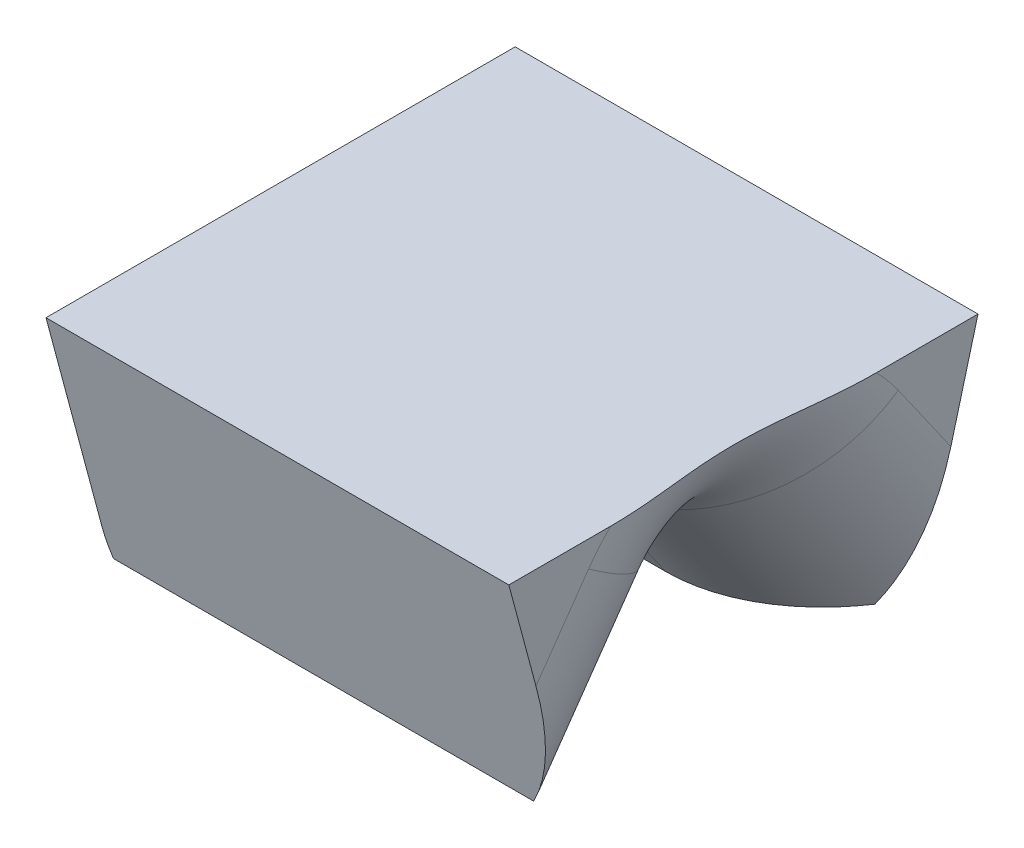
from build123d import *

# Parameters (mm, degrees)
SKETCH_TL_CUTTING_R    = 1.4986
TL_CUTTING_DEPTH       = 75.9968
SKETCH_TDF_CUTTING_W   = 3.01719996
SKETCH_TDF_CUTTING_H   = 3.01719996
TDF_CUTTING_DEPTH      = 77.026345527
VW_VR_GRINDING_DEPTH   = 1.4986
VW_VR_GRINDING_2_DEPTH = 1.4986
ISA_GRINDING_DEPTH     = 1.4986
SKETCH_PRE_FRX_BRX_W   = 1.21682002
SKETCH_PRE_FRX_BRX_H   = 0.83312
SKETCH_PRE_FRX_BRX_W_2 = 1.24935996
PRE_FRX_BRX_DEPTH      = 1.4986
FA_BA_GRINDING_DEPTH   = 1.4986
FR_EDM_R               = 0.1016
BR_EDM_R               = 0.20066
SKETCH_ENGRAVING_W     = 0.033186299
SKETCH_ENGRAVING_H     = 1.128593452
SKETCH_ENGRAVING_H_2   = 1.128593453
ENGRAVING_DEPTH        = 0.005


with BuildPart() as part:
    # sketch_TL_cutting → TL_cutting (new body)
    with BuildSketch(Plane(origin=(0, 0, 0), x_dir=(1, 0, 0), z_dir=(0, 1, 0))):
        with Locations(Location((0, 0, 0), (0, 0, 270))):
            Circle(SKETCH_TL_CUTTING_R)
    extrude(amount=TL_CUTTING_DEPTH)

    # sketch_TDF_cutting → TDF_cutting (cut, through all)
    with BuildSketch(Plane(origin=(0, 0, 0), x_dir=(1, 0, 0), z_dir=(0, 1, 0))):
        with Locations((-2.71001998, 0)):
            Rectangle(SKETCH_TDF_CUTTING_W, SKETCH_TDF_CUTTING_H)
    extrude(amount=TDF_CUTTING_DEPTH, mode=Mode.SUBTRACT)


with BuildPart() as body_2:
    # sketch_VW_VR_grinding → VW_VR_grinding (new, symmetric)
    with BuildSketch(Plane(origin=(0, 0, 0), x_dir=(0, 0, -1), z_dir=(1, 0, 0))):
        with BuildLine():
            Line((-1.49360001, -0.00999998), (-1.49360001, 0.822008914))
            ThreePointArc((-1.49360001, 0.822008914), (-1.493648337, 0.823115792), (-1.493792952, 0.824214246))
            Line((-1.493792952, 0.824214246), (-1.51859996, 0.964901782))
            Line((-1.51859996, 0.964901782), (-1.50859998, -0.00999998))
            Line((-1.50859998, -0.00999998), (-1.49360001, -0.00999998))
        make_face()
    extrude(amount=VW_VR_GRINDING_DEPTH, both=True)


with BuildPart() as body_3:
    # sketch_VW_VR_grinding → VW_VR_grinding 2 (new, symmetric)
    with BuildSketch(Plane(origin=(0, 0, 0), x_dir=(0, 0, -1), z_dir=(1, 0, 0))):
        with BuildLine():
            Line((1.49360001, -0.00999998), (1.49360001, 0.822008914))
            ThreePointArc((1.49360001, 0.822008914), (1.493648337, 0.823115792), (1.493792952, 0.824214246))
            Line((1.493792952, 0.824214246), (1.51859996, 0.964901782))
            Line((1.51859996, 0.964901782), (1.50859998, -0.00999998))
            Line((1.50859998, -0.00999998), (1.49360001, -0.00999998))
        make_face()
    extrude(amount=VW_VR_GRINDING_2_DEPTH, both=True)


    add(body_2.part)  # ISA_grinding merges body 2
    # sketch_ISA_grinding → ISA_grinding (add, symmetric)
    with BuildSketch(Plane(origin=(0, 0, 0), x_dir=(0, 0, -1), z_dir=(1, 0, 0))):
        Polygon((-0.19939, 0), (0.19939, 0), (1.50859998, 4.886038163), (1.50859998, -0.02999994), (-1.50859998, -0.02999994), (-1.50859998, 4.886038163), align=None)
    extrude(amount=ISA_GRINDING_DEPTH, both=True)

    # sketch_pre_FRX_BRX → pre_FRX_BRX (add, symmetric)
    with BuildSketch(Plane.XY):
        with Locations((0.89018999, 0.40656002)):
            Rectangle(SKETCH_PRE_FRX_BRX_W, SKETCH_PRE_FRX_BRX_H)
        with Locations((-0.89391998, 0.40656002)):
            Rectangle(SKETCH_PRE_FRX_BRX_W_2, SKETCH_PRE_FRX_BRX_H)
    extrude(amount=PRE_FRX_BRX_DEPTH, both=True)

    # sketch_FA_BA_grinding → FA_BA_grinding (add, symmetric)
    with BuildSketch(Plane.XY):
        Polygon((0.27178, -0.00999998), (0.27178, 0.83312), (1.6256, 10.466049838), (1.6256, -0.00999998), align=None)
        Polygon((-0.26924, -0.00999998), (-0.26924, 0.83312), (-1.32842, 8.369577303), (-1.32842, -0.00999998), align=None)
    extrude(amount=FA_BA_GRINDING_DEPTH, both=True)


with BuildPart() as part_1:
    add(part.part)

    # B1_fix: cut body 3
    add(body_3.part, mode=Mode.SUBTRACT)

    # V-Groove_EDM: sweep along a path in sketch_contour_V-Groove
    with BuildLine(Plane.XY) as v_groove_edm_path:
        Line((-1.20142, 0.14224), (1.4986, 0.14224))
    # sketch_section_V-Groove → V-Groove_EDM (sweep, cut)
    with BuildSketch(Plane(origin=(-1.20142, 0, -1.2954), x_dir=(0, 0, -1), z_dir=(1, 0, 0))):
        with BuildLine():
            Line((-1.27875483, 0.133575073), (-1.178222496, -0.00999998))
            Line((-1.178222496, -0.00999998), (-1.412577504, -0.00999998))
            Line((-1.412577504, -0.00999998), (-1.31204517, 0.133575073))
            ThreePointArc((-1.31204517, 0.133575073), (-1.2954, 0.14224), (-1.27875483, 0.133575073))
        make_face()
    sweep(path=v_groove_edm_path.line, mode=Mode.SUBTRACT)

    # FR_EDM
    fr_edm_edges = [part_1.edges().sort_by_distance(p)[0] for p in [
        (-0.26924, 0.14224, 0),
        (-0.26924, 0.066787537, -0.063410306),
        (-0.26924, 0.066787537, 0.063410306),
    ]]
    fillet(fr_edm_edges, radius=FR_EDM_R)

    # BR_EDM
    br_edm_edges = [part_1.edges().sort_by_distance(p)[0] for p in [
        (0.27178, 0.066787537, 0.063410306),
        (0.27178, 0.14224, 0),
        (0.27178, 0.066787537, -0.063410306),
    ]]
    fillet(br_edm_edges, radius=BR_EDM_R)

    # sketch_Engraving → Engraving (cut)
    # profile 1 of 14: a face of its own
    with BuildSketch(Plane.ZY.offset(1.20142)):
        Polygon((0.531688452, 45.269846756), (0.531688452, 44.551415224), (0.030264207, 44.92787231), (0.030264207, 44.765052028), (-0.034552784, 44.633862437), (-0.102740259, 44.56723057), (-0.296154161, 44.503450651), (-0.425528876, 44.503450651), (-0.618942778, 44.56723057), (-0.749354564, 44.69842016), (-0.81235668, 44.891834063), (-0.81235668, 45.083433089), (-0.749354564, 45.276846991), (-0.682722697, 45.345293734), (-0.555940662, 45.408295849), (-0.541940192, 45.382887589), (-0.665351744, 45.320663277), (-0.724724108, 45.262846521), (-0.785133544, 45.080062605), (-0.785133544, 44.895463814), (-0.724724108, 44.712420631), (-0.604164504, 44.592638831), (-0.42112132, 44.531451591), (-0.299524645, 44.531451591), (-0.116740729, 44.592638831), (-0.059701777, 44.652270463), (0.001485463, 44.772052263), (0.001485463, 44.985429798), (0.502909708, 44.60923198), (0.502909708, 45.269846756), align=None)
    # profile 2 of 14: a face of its own
    with BuildSketch(Plane.ZY.offset(1.20142)):
        Polygon((-0.79576353, 43.729743189), (-0.79576353, 43.758521933), (0.483723879, 43.758521933), (0.316755309, 43.923157091), (0.254530997, 44.049939126), (0.278902186, 44.064976668), (0.341904302, 43.940528044), (0.531688452, 43.74996609), (0.531688452, 43.729743189), align=None)
    # profile 3 of 14: a face of its own
    with BuildSketch(Plane.ZY.offset(1.20142)):
        Polygon((-0.79576353, 42.579837909), (-0.79576353, 42.608616653), (0.483723879, 42.608616653), (0.316755309, 42.773251811), (0.254530997, 42.900033846), (0.278902186, 42.915071388), (0.341904302, 42.790622765), (0.531688452, 42.60006081), (0.531688452, 42.579837909), align=None)
    # profile 4 of 14: a face of its own
    with BuildSketch(Plane.ZY.offset(1.20142)):
        Polygon((-0.786170615, 41.055549687), (-0.79576353, 41.079920876), (-0.367193584, 41.245333838), (-0.367193584, 41.893763019), (-0.79576353, 42.059175981), (-0.786170615, 42.08354717), (0.531688452, 41.578752441), (0.531688452, 41.559566612), align=None)
        Polygon((-0.340748251, 41.255704557), (0.478538519, 41.569159527), (-0.340748251, 41.883133033), align=None, mode=Mode.SUBTRACT)
    # profile 5 of 14: a face of its own
    with BuildSketch(Plane.ZY.offset(1.20142)):
        with Locations((-0.231596438, 40.285083075)):
            Rectangle(SKETCH_ENGRAVING_W, SKETCH_ENGRAVING_H)
    # profile 6 of 14: a face of its own
    with BuildSketch(Plane.ZY.offset(1.20142)):
        Polygon((0.515095302, 38.490248732), (-0.79576353, 38.988821029), (-0.79576353, 39.018636845), (0.521058466, 39.518246214), (0.531688452, 39.493875025), (-0.756354799, 39.003858571), (0.525466021, 38.514619921), align=None)
    # profile 7 of 14: a face of its own
    with BuildSketch(Plane.ZY.offset(1.20142)):
        Polygon((-0.786170615, 38.108295165), (0.502909708, 37.49227448), (0.502909708, 38.347080961), (0.531688452, 38.347080961), (0.531688452, 37.44508771), (-0.79576353, 38.083664709), align=None)
    # profile 8 of 14: a face of its own
    with BuildSketch(Plane.ZY.offset(1.20142)):
        Polygon((-0.554125786, 36.366740389), (-0.749354564, 36.498189247), (-0.81235668, 36.693158757), (-0.81235668, 36.82279274), (-0.749354564, 37.01776225), (-0.554125786, 37.148174036), (-0.237559601, 37.211176152), (-0.044923503, 37.211176152), (0.271901951, 37.148174036), (0.466871461, 37.01776225), (0.531688452, 36.82279274), (0.531688452, 36.693158757), (0.466871461, 36.498189247), (0.271901951, 36.366740389), (-0.044923503, 36.304775345), (-0.237559601, 36.304775345), align=None)
        Polygon((-0.539347512, 36.395778401), (-0.22874449, 36.332776285), (-0.044923503, 36.332776285), (0.26567952, 36.395778401), (0.446907827, 36.515560201), (0.507057995, 36.696788509), (0.507057995, 36.818385184), (0.446907827, 36.999613492), (0.26567952, 37.120173096), (-0.044923503, 37.182397408), (-0.22874449, 37.182397408), (-0.539347512, 37.120173096), (-0.72057582, 36.999613492), (-0.780985256, 36.818385184), (-0.780985256, 36.696788509), (-0.72057582, 36.515560201), align=None, mode=Mode.SUBTRACT)
    # profile 9 of 14: a face of its own
    with BuildSketch(Plane.ZY.offset(1.20142)):
        with Locations((-0.231596438, 35.419971561)):
            Rectangle(SKETCH_ENGRAVING_W, SKETCH_ENGRAVING_H_2)
    # profile 10 of 14: a face of its own
    with BuildSketch(Plane.ZY.offset(1.20142)):
        Polygon((-0.541940192, 34.502759279), (-0.665351744, 34.440534968), (-0.724724108, 34.382718211), (-0.785133544, 34.199934296), (-0.785133544, 34.015335505), (-0.724724108, 33.832292321), (-0.604164504, 33.712510521), (-0.42112132, 33.651323281), (-0.299524645, 33.651323281), (-0.116740729, 33.712510521), (0.003041071, 33.832292321), (0.064487579, 34.015335505), (0.064487579, 34.199934296), (0.003041071, 34.382718211), (-0.086924913, 34.470350784), (0.531688452, 34.402941113), (0.531688452, 33.762289971), (0.502909708, 33.762289971), (0.502909708, 34.377532852), (-0.007329648, 34.434312537), (0.028449332, 34.396718682), (0.092488519, 34.203304779), (0.092488519, 34.011705753), (0.028449332, 33.818291851), (-0.102740259, 33.687102261), (-0.296154161, 33.623322341), (-0.425528876, 33.623322341), (-0.618942778, 33.687102261), (-0.749354564, 33.818291851), (-0.81235668, 34.011705753), (-0.81235668, 34.203304779), (-0.749354564, 34.396718682), (-0.682722697, 34.465165424), (-0.555940662, 34.52816754), align=None)
    # profile 11 of 14: a face of its own
    with BuildSketch(Plane.ZY.offset(1.20142)):
        Polygon((-0.554125786, 32.535382105), (-0.749354564, 32.666830964), (-0.81235668, 32.861800473), (-0.81235668, 32.991434456), (-0.749354564, 33.186403966), (-0.554125786, 33.316815753), (-0.237559601, 33.379817868), (-0.044923503, 33.379817868), (0.271901951, 33.316815753), (0.466871461, 33.186403966), (0.531688452, 32.991434456), (0.531688452, 32.861800473), (0.466871461, 32.666830964), (0.271901951, 32.535382105), (-0.044923503, 32.473417061), (-0.237559601, 32.473417061), align=None)
        Polygon((-0.539347512, 32.564420117), (-0.22874449, 32.501418002), (-0.044923503, 32.501418002), (0.26567952, 32.564420117), (0.446907827, 32.684201917), (0.507057995, 32.865430225), (0.507057995, 32.987026901), (0.446907827, 33.168255208), (0.26567952, 33.288814812), (-0.044923503, 33.351039124), (-0.22874449, 33.351039124), (-0.539347512, 33.288814812), (-0.72057582, 33.168255208), (-0.780985256, 32.987026901), (-0.780985256, 32.865430225), (-0.72057582, 32.684201917), align=None, mode=Mode.SUBTRACT)
    # profile 12 of 14: a face of its own
    with BuildSketch(Plane.ZY.offset(1.20142)):
        Polygon((-0.554125786, 31.385476826), (-0.749354564, 31.516925684), (-0.81235668, 31.711895194), (-0.81235668, 31.841529177), (-0.749354564, 32.036498686), (-0.554125786, 32.166910473), (-0.237559601, 32.229912589), (-0.044923503, 32.229912589), (0.271901951, 32.166910473), (0.466871461, 32.036498686), (0.531688452, 31.841529177), (0.531688452, 31.711895194), (0.466871461, 31.516925684), (0.271901951, 31.385476826), (-0.044923503, 31.323511782), (-0.237559601, 31.323511782), align=None)
        Polygon((-0.539347512, 31.414514838), (-0.22874449, 31.351512722), (-0.044923503, 31.351512722), (0.26567952, 31.414514838), (0.446907827, 31.534296638), (0.507057995, 31.715524945), (0.507057995, 31.837121621), (0.446907827, 32.018349929), (0.26567952, 32.138909533), (-0.044923503, 32.201133844), (-0.22874449, 32.201133844), (-0.539347512, 32.138909533), (-0.72057582, 32.018349929), (-0.780985256, 31.837121621), (-0.780985256, 31.715524945), (-0.72057582, 31.534296638), align=None, mode=Mode.SUBTRACT)
    # profile 13 of 14: a face of its own
    with BuildSketch(Plane.ZY.offset(1.20142)):
        with Locations((-0.231596438, 30.438707997)):
            Rectangle(SKETCH_ENGRAVING_W, SKETCH_ENGRAVING_H_2)
    # profile 14 of 14: a face of its own
    with BuildSketch(Plane.ZY.offset(1.20142)):
        Polygon((-0.79576353, 29.018256595), (-0.79576353, 29.04703534), (0.483723879, 29.04703534), (0.316755309, 29.211670497), (0.254530997, 29.338452532), (0.278902186, 29.353490074), (0.341904302, 29.229041451), (0.531688452, 29.038479497), (0.531688452, 29.018256595), align=None)
    extrude(amount=-ENGRAVING_DEPTH, mode=Mode.SUBTRACT)

    # SurfaceCut1
    split(bisect_by=Plane(origin=(0, 0.279226503, 0), x_dir=(1, 0, 0), z_dir=(0, 1, 0)), keep=Keep.BOTTOM)


solid = part_1.part
